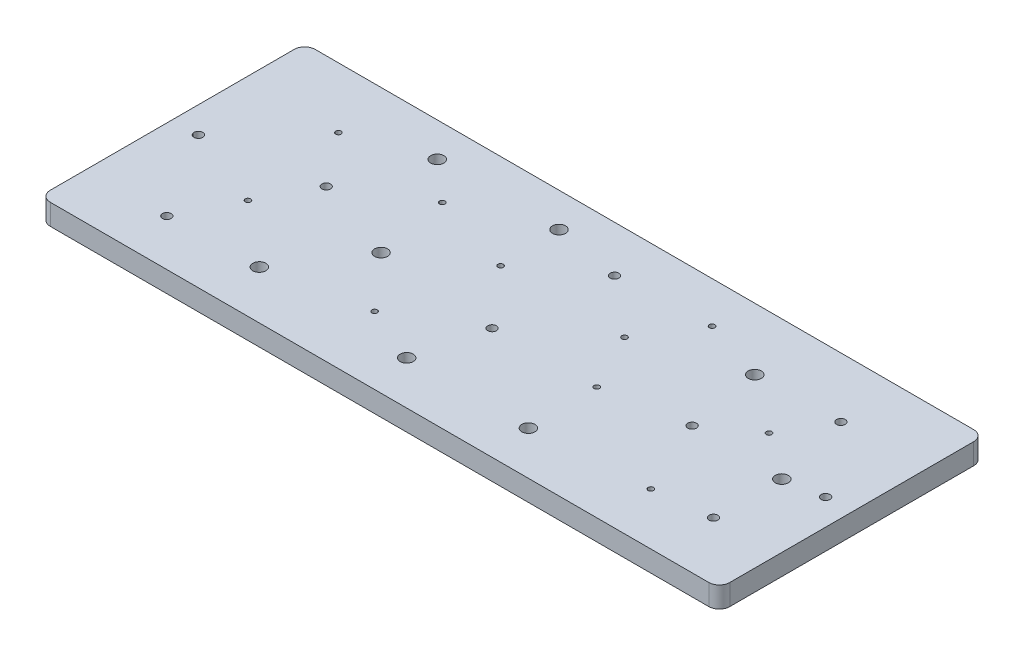
from build123d import *

# Parameters (mm, degrees)
SKETCH1_W                    = 650
SKETCH1_H                    = 253.35
BOSS_EXTRUDE1_DEPTH          = 20
FILLET1_R                    = 10
F_5_2_5_2_DIAMETER_HOLE1_D   = 5.2
F_8_3_8_3_DIAMETER_HOLE1_D   = 8.3
F_12_5_12_5_DIAMETER_HOLE1_D = 12.5
M8_CLEARANCE_HOLE1_D         = 8.4
M8_CLEARANCE_HOLE1_DEPTH     = 30
M8_CLEARANCE_HOLE1_TIP       = 2.5236146


with BuildPart() as part:
    # Sketch1 → Boss-Extrude1 (new body)
    with BuildSketch(Plane(origin=(0, 0, 0), x_dir=(1, 0, 0), z_dir=(0, 1, 0))):
        with Locations((325, 126.675)):
            Rectangle(SKETCH1_W, SKETCH1_H)
    extrude(amount=BOSS_EXTRUDE1_DEPTH)

    # Fillet1
    fillet1_edges = [part.edges().sort_by_distance(p)[0] for p in [
        (0, 10, 0),
        (0, 10, -253.35),
        (650, 10, -253.35),
        (650, 10, 0),
    ]]
    fillet(fillet1_edges, radius=FILLET1_R)

    # Ø5.2 (5.2) Diameter Hole1 (through all)
    with Locations(Plane(origin=(0, 20, 0), x_dir=(1, 0, 0), z_dir=(0, 1, 0))):
        with Locations((90.058331561, 195.482500532), (255.538984983, 64.732354618), (396.503986047, 162.794964053), (544.959880887, 152.580108904), (534.745025737, 49.750567065), (278.011666312, 162.794964053), (102.997148083, 96.05791041), (429.191522525, 213.869239801), (424.424590122, 108.315736589), (197.654805802, 187.310616412)):
            Hole(F_5_2_5_2_DIAMETER_HOLE1_D / 2)

    # Ø8.3 (8.3) Diameter Hole1 (through all)
    with Locations(Plane(origin=(0, 20, 0), x_dir=(1, 0, 0), z_dir=(0, 1, 0))):
        with Locations((128.874781129, 145.089215127), (77.119515038, 44.302644319), (325.680990343, 106.953755902), (340.662777896, 209.102307398), (502.057489259, 121.935543455), (570.156523589, 196.163490875), (588.543262858, 55.879480155)):
            Hole(F_8_3_8_3_DIAMETER_HOLE1_D / 2)

    # Ø12.5 (12.5) Diameter Hole1 (through all)
    with Locations(Plane(origin=(0, 20, 0), x_dir=(1, 0, 0), z_dir=(0, 1, 0))):
        with Locations((209.912631982, 116.487620709), (425.786570809, 41.578682945), (489.799663079, 194.120519845), (309.337222104, 41.578682945), (163.605288637, 46.345615349), (159.519346577, 220.679143234), (275.968695282, 220.679143234), (589.224253201, 120.573562769)):
            Hole(F_12_5_12_5_DIAMETER_HOLE1_D / 2)

    # M8 Clearance Hole1
    with Locations(Plane(origin=(0, 20, 0), x_dir=(1, 0, 0), z_dir=(0, 1, 0))):
        with Locations((25, 126.675), (625, 126.675)):
            Hole(M8_CLEARANCE_HOLE1_D / 2, depth=M8_CLEARANCE_HOLE1_DEPTH)
            with Locations((0, 0, -(M8_CLEARANCE_HOLE1_DEPTH + M8_CLEARANCE_HOLE1_TIP / 2))):  # 118° drill point
                Cone(0, M8_CLEARANCE_HOLE1_D / 2, M8_CLEARANCE_HOLE1_TIP, mode=Mode.SUBTRACT)


solid = part.part
